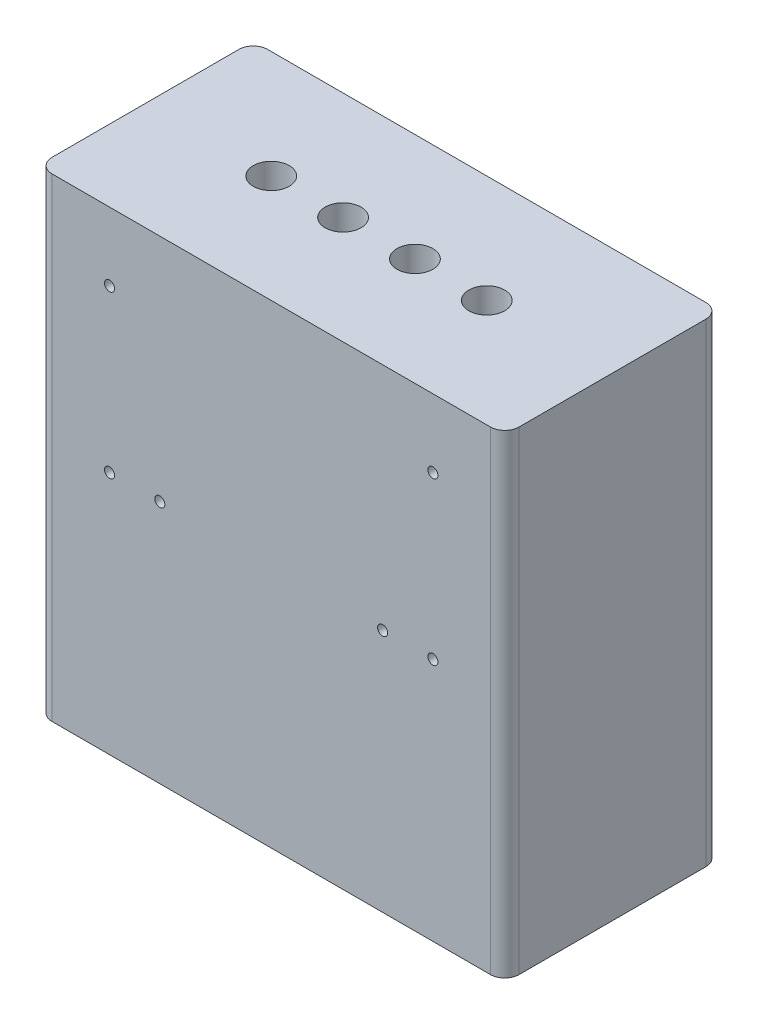
from build123d import *

# Parameters (mm, degrees)
SKETCH1_W           = 82.55
SKETCH1_H           = 83.82
BOSS_EXTRUDE1_DEPTH = 19.05
SKETCH2_R           = 0.889
CUT_EXTRUDE1_DEPTH  = 71.083405489
FILLET1_R           = 2.54
SKETCH3_R           = 3.175
CUT_EXTRUDE2_DEPTH  = 38.1


with BuildPart() as part:
    # Sketch1 → Boss-Extrude1 (new, symmetric)
    with BuildSketch(Plane.XY):
        Rectangle(SKETCH1_W, SKETCH1_H)
    extrude(amount=BOSS_EXTRUDE1_DEPTH, both=True)

    # Sketch2 → Cut-Extrude1 (cut, through all)
    with BuildSketch(Plane.XY.offset(19.05)):
        with Locations((-28.575, 29.845)):
            Circle(SKETCH2_R)
        with Locations((28.575, 29.845)):
            Circle(SKETCH2_R)
        with Locations((28.575, 1.27)):
            Circle(SKETCH2_R)
        with Locations((-28.575, 1.27)):
            Circle(SKETCH2_R)
        with Locations((-19.685, 1.27)):
            Circle(SKETCH2_R)
        with Locations((19.685, 1.27)):
            Circle(SKETCH2_R)
    extrude(amount=-CUT_EXTRUDE1_DEPTH, mode=Mode.SUBTRACT)

    # Fillet1
    fillet1_edges = [part.edges().sort_by_distance(p)[0] for p in [
        (-41.275, 0, 19.05),
        (41.275, 0, 19.05),
        (-41.275, 0, -19.05),
        (41.275, 0, -19.05),
    ]]
    fillet(fillet1_edges, radius=FILLET1_R)

    # Sketch3 → Cut-Extrude2 (cut)
    with BuildSketch(Plane(origin=(0, 41.91, 0), x_dir=(1, 0, 0), z_dir=(0, 1, 0))):
        with Locations(Location((-6.35, 0, 0), (0, 0, 270))):
            Circle(SKETCH3_R)
        with Locations(Location((6.35, 0, 0), (0, 0, 270))):
            Circle(SKETCH3_R)
        with Locations(Location((19.05, 0, 0), (0, 0, 270))):
            Circle(SKETCH3_R)
        with Locations(Location((-19.05, 0, 0), (0, 0, 270))):
            Circle(SKETCH3_R)
    extrude(amount=-CUT_EXTRUDE2_DEPTH, mode=Mode.SUBTRACT)


solid = part.part
